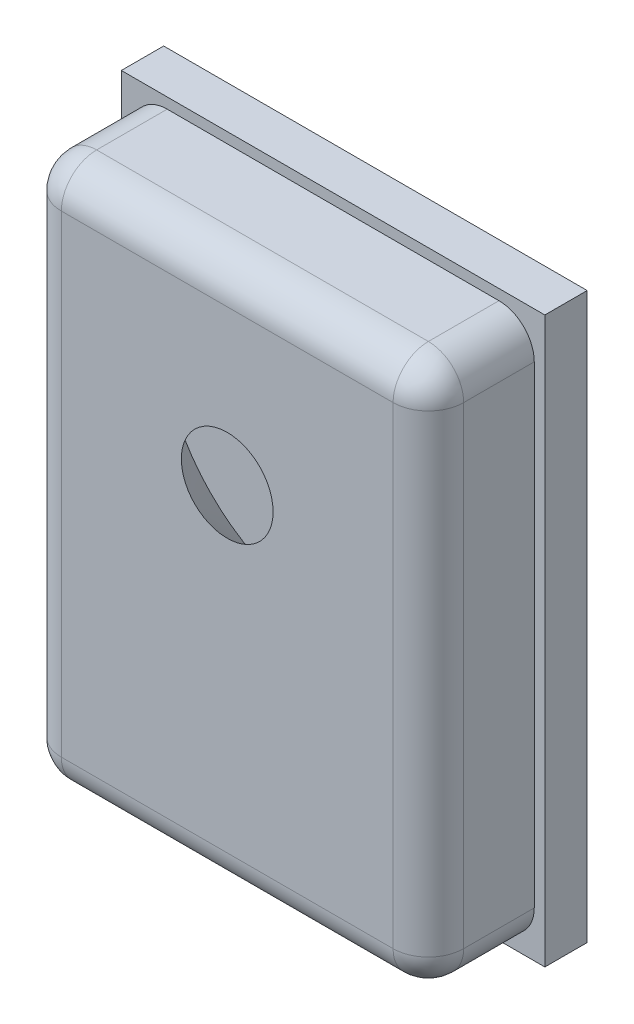
from build123d import *

# Parameters (mm, degrees)
SKETCH_1_W          = 3
SKETCH_1_H          = 4
EXTRUDE_1_DEPTH     = 0.3
EXTRUDE_2_DEPTH     = 0.75
FILLET_1_R          = 0.25
SKETCH_3_R          = 0.325
CUT_EXTRUDE_1_DEPTH = 0.75
CUT_EXTRUDE_1_DRAFT = 50
SKETCH_4_W          = 0.9
SKETCH_4_H          = 0.6
EXTRUDE_3_DEPTH     = 0.05


with BuildPart() as part:
    # Эскиз1 → Бобышка-Вытянуть1 (new body)
    with BuildSketch(Plane.XY):
        Rectangle(SKETCH_1_W, SKETCH_1_H)
    extrude(amount=EXTRUDE_1_DEPTH)

    # Эскиз2 → Бобышка-Вытянуть2 (add)
    with BuildSketch(Plane.XY.offset(0.3)):
        with BuildLine():
            Line((-1.175, 1.925), (1.175, 1.925))
            ThreePointArc((1.175, 1.925), (1.351776695, 1.851776695), (1.425, 1.675))
            Line((1.425, 1.675), (1.425, -1.675))
            ThreePointArc((1.425, -1.675), (1.351776695, -1.851776695), (1.175, -1.925))
            Line((1.175, -1.925), (-1.175, -1.925))
            ThreePointArc((-1.175, -1.925), (-1.351776695, -1.851776695), (-1.425, -1.675))
            Line((-1.425, -1.675), (-1.425, 1.675))
            ThreePointArc((-1.425, 1.675), (-1.351776695, 1.851776695), (-1.175, 1.925))
        make_face()
    extrude(amount=EXTRUDE_2_DEPTH)

    # Скругление1
    fillet_1_edges = [part.edges().sort_by_distance(p)[0] for p in [
        (-1.351776695, -1.851776695, 1.05),
        (0, -1.925, 1.05),
        (1.351776695, -1.851776695, 1.05),
        (1.425, 0, 1.05),
        (1.351776695, 1.851776695, 1.05),
        (0, 1.925, 1.05),
        (-1.351776695, 1.851776695, 1.05),
        (-1.425, 0, 1.05),
    ]]
    fillet(fillet_1_edges, radius=FILLET_1_R)


with BuildPart() as cut_extrude_1_tool:
    # Эскиз3 → Вырез-Вытянуть1 (with draft: the straight prism first)
    with BuildSketch(Plane.XY.offset(1.05)):
        with Locations((0, 0.58)):
            Circle(SKETCH_3_R)
    extrude(amount=-CUT_EXTRUDE_1_DEPTH)
    # Вырез-Вытянуть1: the draft: its side faces are tilted about the plane it starts from
    cut_extrude_1_sides = [cut_extrude_1_tool.faces().sort_by_distance(p)[0] for p in [
        (-0.325, 0.58, 0.675),
    ]]
    draft(cut_extrude_1_sides, Plane.XY.offset(1.05), CUT_EXTRUDE_1_DRAFT)


with BuildPart() as part_1:
    add(part.part)

    # Вырез-Вытянуть1: cut by cut_extrude_1_tool
    add(cut_extrude_1_tool.part, mode=Mode.SUBTRACT)

    # Эскиз4 → Бобышка-Вытянуть3 (add)
    with BuildSketch(Plane(origin=(0, 0, 0), x_dir=(-1, 0, 0), z_dir=(0, 0, -1))):
        with Locations((-0.95, -1.5)):
            Rectangle(SKETCH_4_W, SKETCH_4_H)
        with Locations((0.95, -1.5)):
            Rectangle(SKETCH_4_W, SKETCH_4_H)
        with Locations((0.95, -0.5)):
            Rectangle(SKETCH_4_W, SKETCH_4_H)
        with Locations((0.95, 0.5)):
            Rectangle(SKETCH_4_W, SKETCH_4_H)
        with Locations((0.95, 1.5)):
            Rectangle(SKETCH_4_W, SKETCH_4_H)
        with Locations((-0.95, -0.5)):
            Rectangle(SKETCH_4_W, SKETCH_4_H)
        with Locations((-0.95, 0.5)):
            Rectangle(SKETCH_4_W, SKETCH_4_H)
        with Locations((-0.95, 1.5)):
            Rectangle(SKETCH_4_W, SKETCH_4_H)
    extrude(amount=EXTRUDE_3_DEPTH)


solid = part_1.part
